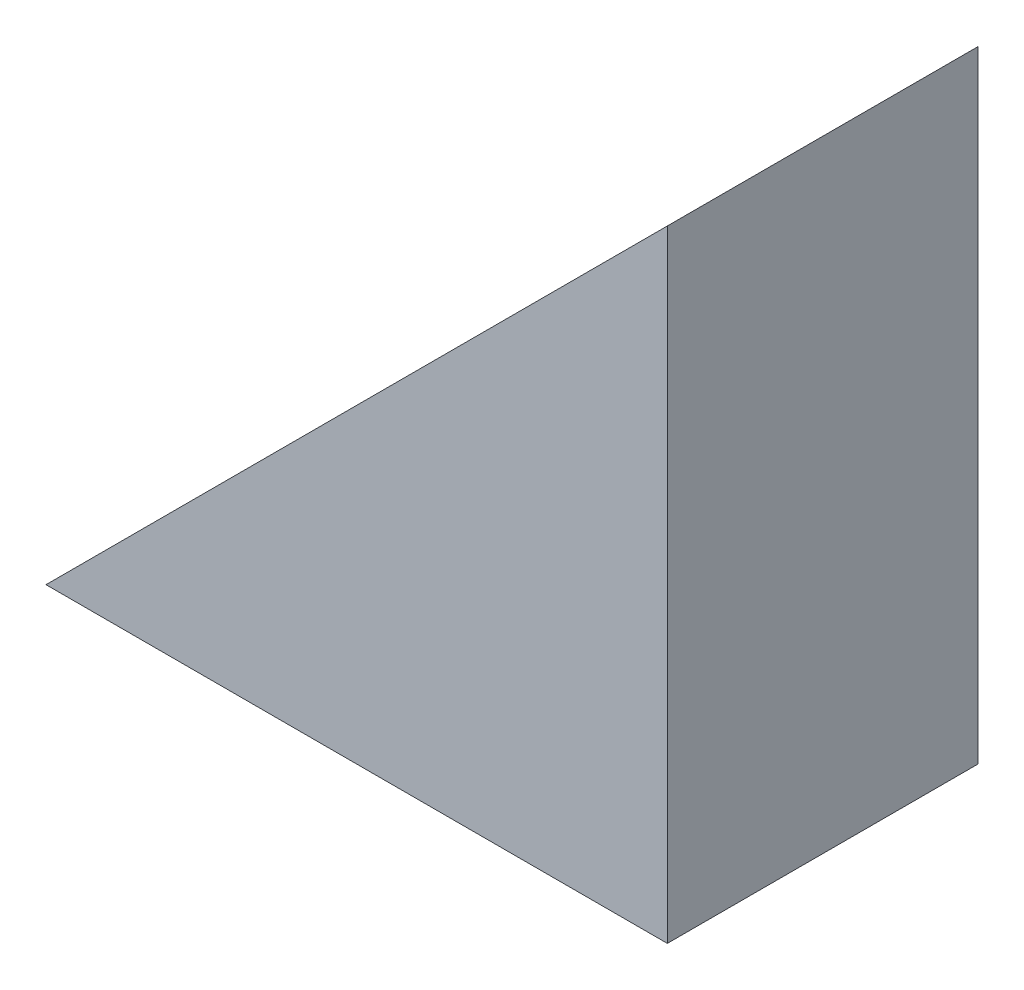
from build123d import *

# Parameters (mm, degrees)
AUFSATZ_LINEAR_AUSTRAGEN1_DEPTH = 20


with BuildPart() as part:
    # Skizze2 → Aufsatz-Linear austragen1 (new body)
    with BuildSketch(Plane.XY):
        Polygon((0, 0), (40, 0), (40, 40), align=None)
    extrude(amount=AUFSATZ_LINEAR_AUSTRAGEN1_DEPTH)


solid = part.part
